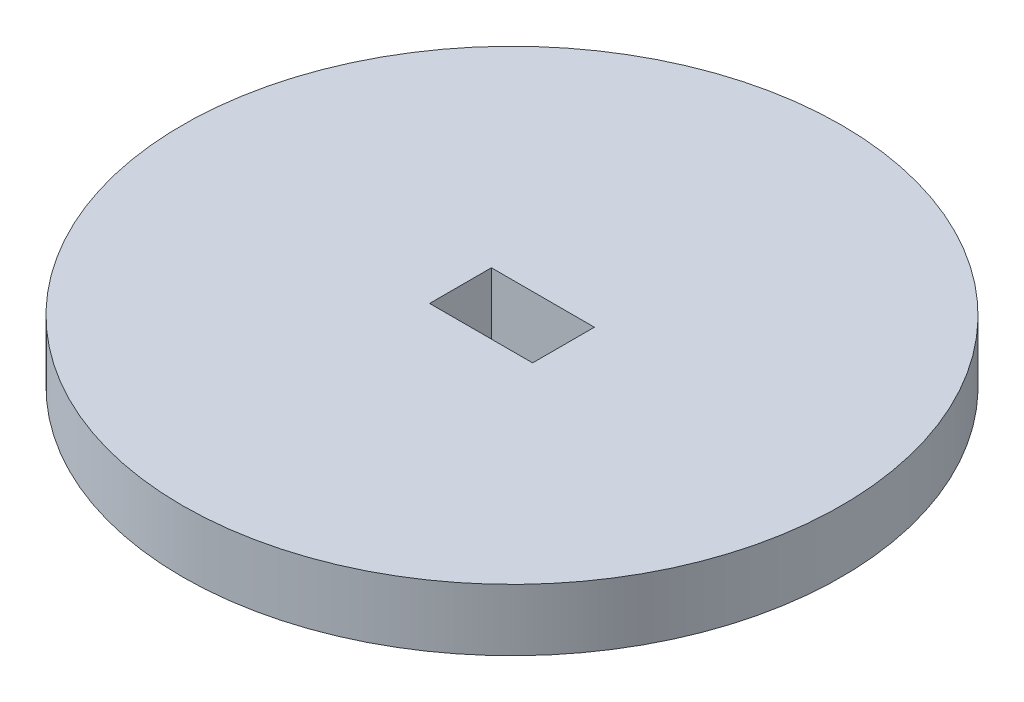
from build123d import *

# Parameters (mm, degrees)
ESBO_O1_R                = 32
RESSALTO_EXTRUS_O1_DEPTH = 6
ESBO_O2_W                = 10
ESBO_O2_H                = 6
CORTE_EXTRUS_O1_DEPTH    = 6


with BuildPart() as part:
    # Esboço1 → Ressalto-extrusão1 (new body)
    with BuildSketch(Plane(origin=(0, 0, 0), x_dir=(1, 0, 0), z_dir=(0, 1, 0))):
        with Locations(Location((0, 0, 0), (0, 0, 270))):
            Circle(ESBO_O1_R)
    extrude(amount=RESSALTO_EXTRUS_O1_DEPTH)

    # Esboço2 → Corte-extrusão1 (cut)
    with BuildSketch(Plane(origin=(0, 6, 0), x_dir=(1, 0, 0), z_dir=(0, 1, 0))):
        Rectangle(ESBO_O2_W, ESBO_O2_H)
    extrude(amount=-CORTE_EXTRUS_O1_DEPTH, mode=Mode.SUBTRACT)


solid = part.part
